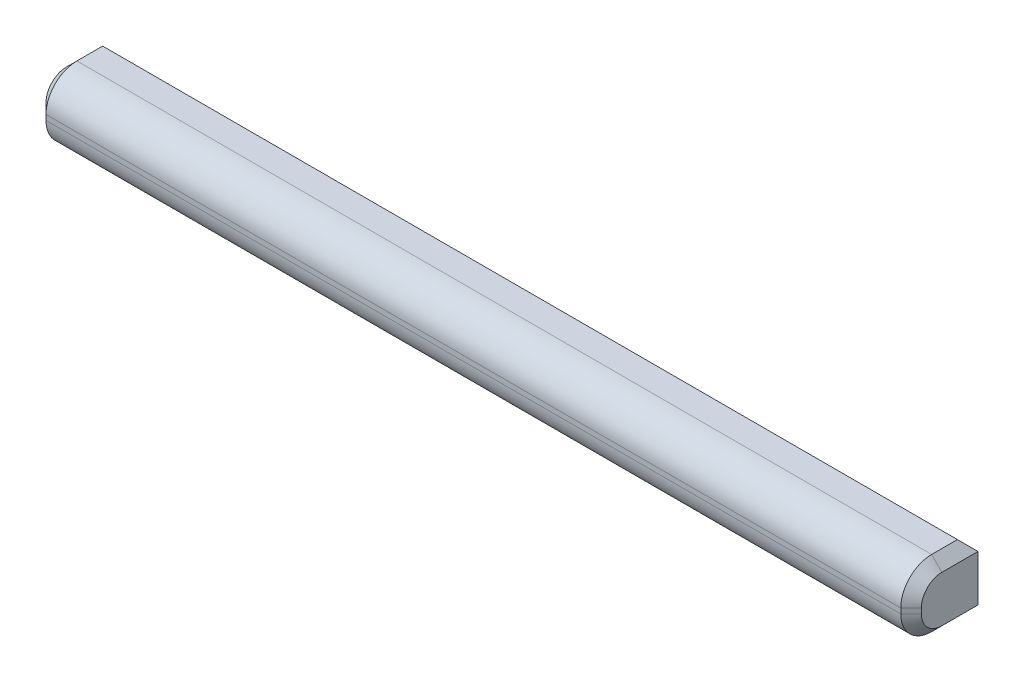
from build123d import *

# Parameters (mm, degrees)
CROQUIS2_W              = 6.5
CROQUIS2_H              = 6.5
SALIENTE_EXTRUIR1_DEPTH = 85
REDONDEO1_R             = 3
CHAFL_N1_SIZE           = 1


with BuildPart() as part:
    # Croquis2 → Saliente-Extruir1 (new body)
    with BuildSketch(Plane(origin=(0, 0, 0), x_dir=(0, 0, -1), z_dir=(1, 0, 0))):
        with Locations((-3.25, 3.25)):
            Rectangle(CROQUIS2_W, CROQUIS2_H)
    extrude(amount=SALIENTE_EXTRUIR1_DEPTH)

    # Redondeo1
    redondeo1_edges = [part.edges().sort_by_distance(p)[0] for p in [
        (42.5, 0, 6.5),
        (42.5, 6.5, 6.5),
    ]]
    fillet(redondeo1_edges, radius=REDONDEO1_R)

    # Chaflán1
    chafl_n1_edges = [part.edges().sort_by_distance(p)[0] for p in [
        (0, 0, 1.75),
        (85, 0, 1.75),
        (0, 3.25, 6.5),
        (0, 5.621320344, 5.621320344),
        (0, 0.878679656, 5.621320344),
        (85, 3.25, 6.5),
        (85, 5.621320344, 5.621320344),
        (85, 0.878679656, 5.621320344),
        (0, 6.5, 1.75),
        (85, 6.5, 1.75),
        (42.5, 0, 0),
        (42.5, 6.5, 0),
    ]]
    chamfer(chafl_n1_edges, length=CHAFL_N1_SIZE)


solid = part.part
